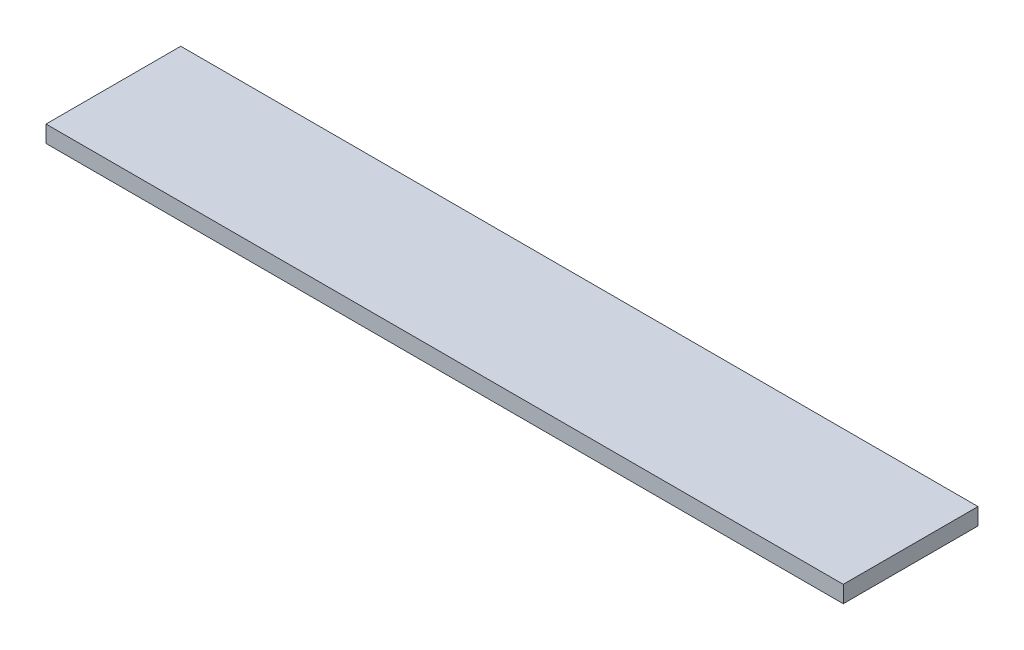
from build123d import *

# Parameters (mm, degrees)
SKETCH1_W           = 901.7
SKETCH1_H           = 152.4
BOSS_EXTRUDE1_DEPTH = 9.525


with BuildPart() as part:
    # Sketch1 → Boss-Extrude1 (new, symmetric)
    with BuildSketch(Plane(origin=(0, 0, 0), x_dir=(1, 0, 0), z_dir=(0, 1, 0))):
        Rectangle(SKETCH1_W, SKETCH1_H)
    extrude(amount=BOSS_EXTRUDE1_DEPTH, both=True)


solid = part.part
